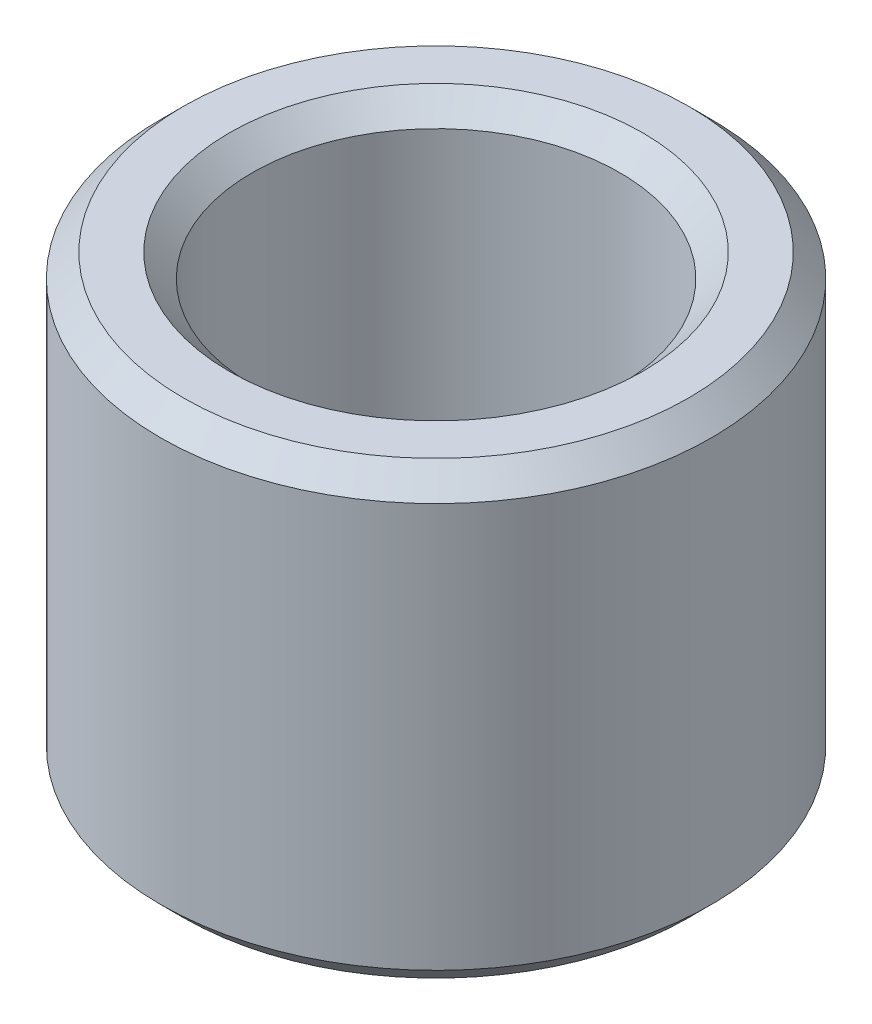
from build123d import *

# Parameters (mm, degrees)
SKETCH_1_R      = 3
SKETCH_1_R_2    = 2
EXTRUDE_1_DEPTH = 2.45
CHAMFER_1_SIZE  = 0.25


with BuildPart() as part:
    # ｽｹｯﾁ1 → ﾎﾞｽ - 押し出し1 (new, symmetric)
    with BuildSketch(Plane(origin=(0, 0, 0), x_dir=(1, 0, 0), z_dir=(0, 1, 0))):
        with Locations(Location((0, 0, 0), (0, 0, 270))):
            Circle(SKETCH_1_R)
        with Locations(Location((0, 0, 0), (0, 0, 270))):
            Circle(SKETCH_1_R_2, mode=Mode.SUBTRACT)
    extrude(amount=EXTRUDE_1_DEPTH, both=True)

    # 面取り1
    chamfer_1_edges = [part.edges().sort_by_distance(p)[0] for p in [
        (0, -2.45, -3),
        (0, 2.45, -3),
        (0, -2.45, -2),
        (0, 2.45, -2),
    ]]
    chamfer(chamfer_1_edges, length=CHAMFER_1_SIZE)


solid = part.part
